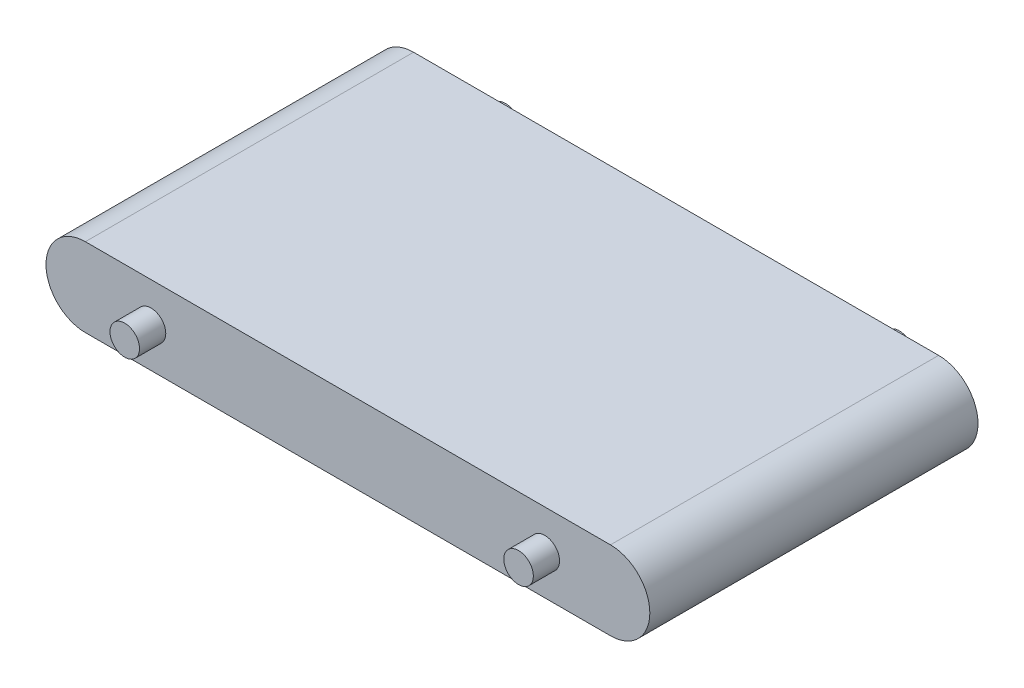
from build123d import *

# Parameters (mm, degrees)
SKETCH2_W           = 460
SKETCH2_H           = 60
BOSS_EXTRUDE1_DEPTH = 125
FILLET1_RADIUS      = 30
FILLET1_LENGTH      = 250
FILLET2_RADIUS      = 30
FILLET2_LENGTH      = 250
SKETCH3_R           = 11.25
BOSS_EXTRUDE2_DEPTH = 20


with BuildPart() as part:
    # Sketch2 → Boss-Extrude1 (new, symmetric)
    with BuildSketch(Plane.XY):
        Rectangle(SKETCH2_W, SKETCH2_H)
    extrude(amount=BOSS_EXTRUDE1_DEPTH, both=True)

    # Fillet1: full round fillet: the end face becomes a half cylinder, R = half its width
    fillet1_face = Plane((-230, 0, 0), x_dir=(0, 0, 1), z_dir=(-1, 0, 0))  # on the end face: x along it, z out of the body
    fillet1_slab = fillet1_face.offset(-FILLET1_RADIUS / 2) * Box(FILLET1_LENGTH, 2 * FILLET1_RADIUS, FILLET1_RADIUS, mode=Mode.PRIVATE)  # the body's end, R deep
    fillet1_round = Plane((-200, 0, 0), x_dir=(-1, 0, 0), z_dir=(0, 0, 1)) * Cylinder(FILLET1_RADIUS, FILLET1_LENGTH, mode=Mode.PRIVATE)  # its axis R under the face
    add(fillet1_slab - fillet1_round, mode=Mode.SUBTRACT)

    # Fillet2: full round fillet: the end face becomes a half cylinder, R = half its width
    fillet2_face = Plane((230, 0, 0), x_dir=(0, 0, -1), z_dir=(1, 0, 0))  # on the end face: x along it, z out of the body
    fillet2_slab = fillet2_face.offset(-FILLET2_RADIUS / 2) * Box(FILLET2_LENGTH, 2 * FILLET2_RADIUS, FILLET2_RADIUS, mode=Mode.PRIVATE)  # the body's end, R deep
    fillet2_round = Plane((200, 0, 0), x_dir=(1, 0, 0), z_dir=(0, 0, -1)) * Cylinder(FILLET2_RADIUS, FILLET2_LENGTH, mode=Mode.PRIVATE)  # its axis R under the face
    add(fillet2_slab - fillet2_round, mode=Mode.SUBTRACT)

    # Sketch3 → Boss-Extrude2 (add)
    with BuildSketch(Plane.XY.offset(125)):
        with Locations((-150, 0)):
            Circle(SKETCH3_R)
        with Locations((150, 0)):
            Circle(SKETCH3_R)
    boss_extrude2 = extrude(amount=BOSS_EXTRUDE2_DEPTH)

    # Mirror1: Boss-Extrude2 across plane
    add(boss_extrude2.mirror(Plane.XY))


solid = part.part
